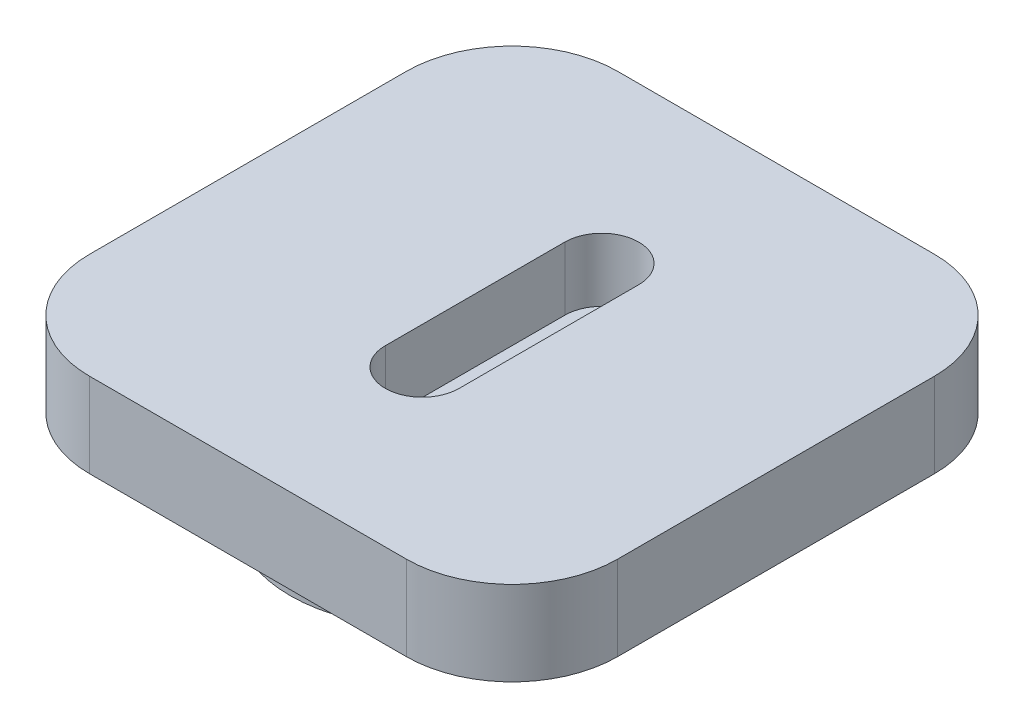
from build123d import *

# Parameters (mm, degrees)
SKETCH_1_W          = 50
SKETCH_1_H          = 50
EXTRUDE_1_DEPTH     = 12.5
FILLET_1_R          = 10
CUT_EXTRUDE_1_DEPTH = 6
SKETCH_3_R          = 3.375
CUT_EXTRUDE_2_DEPTH = 6
SKETCH_4_R          = 8.75
CUT_EXTRUDE_3_DEPTH = 3
SKETCH_5_W          = 67.74325056
SKETCH_5_H          = 59.124248938
SKETCH_5_R          = 12.5
CUT_EXTRUDE_4_DEPTH = 4.5
SKETCH_6_R          = 11.25
SKETCH_6_R_2        = 10.25
CUT_EXTRUDE_5_DEPTH = 2


with BuildPart() as part:
    # 草图1 → 凸台-拉伸1 (new body)
    with BuildSketch(Plane(origin=(0, 0, 0), x_dir=(1, 0, 0), z_dir=(0, 1, 0))):
        Rectangle(SKETCH_1_W, SKETCH_1_H)
    extrude(amount=EXTRUDE_1_DEPTH)

    # 圆角1
    fillet_1_edges = [part.edges().sort_by_distance(p)[0] for p in [
        (-25, 6.25, -25),
        (25, 6.25, -25),
        (25, 6.25, 25),
        (-25, 6.25, 25),
    ]]
    fillet(fillet_1_edges, radius=FILLET_1_R)

    # 草图2 → 切除-拉伸1 (cut)
    with BuildSketch(Plane(origin=(0, 12.5, 0), x_dir=(1, 0, 0), z_dir=(0, 1, 0))):
        with BuildLine():
            Line((3.5, 8.5), (3.5, -8.5))
            ThreePointArc((3.5, -8.5), (0, -12), (-3.5, -8.5))
            Line((-3.5, -8.5), (-3.5, 8.5))
            ThreePointArc((-3.5, 8.5), (0, 12), (3.5, 8.5))
        make_face()
    extrude(amount=-CUT_EXTRUDE_1_DEPTH, mode=Mode.SUBTRACT)

    # 草图3 → 切除-拉伸2 (cut)
    with BuildSketch(Plane(origin=(0, 6.5, 0), x_dir=(1, 0, 0), z_dir=(0, 1, 0))):
        with Locations(Location((0, -8.5, 0), (0, 0, 270))):
            Circle(SKETCH_3_R)
    extrude(amount=-CUT_EXTRUDE_2_DEPTH, mode=Mode.SUBTRACT)

    # 草图4 → 切除-拉伸3 (cut)
    with BuildSketch(Plane(origin=(0, 0, 0), x_dir=(-1, 0, 0), z_dir=(0, -1, 0))):
        with Locations(Location((0, -8.5, 0), (0, 0, 90))):
            Circle(SKETCH_4_R)
    extrude(amount=-CUT_EXTRUDE_3_DEPTH, mode=Mode.SUBTRACT)

    # 草图5 → 切除-拉伸4 (cut)
    with BuildSketch(Plane(origin=(0, 0, 0), x_dir=(-1, 0, 0), z_dir=(0, -1, 0))):
        with Locations((1.182484979, -0.052554888)):
            Rectangle(SKETCH_5_W, SKETCH_5_H)
        with Locations(Location((0, -8.5, 0), (0, 0, 90))):
            Circle(SKETCH_5_R, mode=Mode.SUBTRACT)
    extrude(amount=-CUT_EXTRUDE_4_DEPTH, mode=Mode.SUBTRACT)

    # 草图6 → 切除-拉伸5 (cut)
    with BuildSketch(Plane(origin=(0, 0, 0), x_dir=(-1, 0, 0), z_dir=(0, -1, 0))):
        with Locations(Location((0, -8.5, 0), (0, 0, 90))):
            Circle(SKETCH_6_R)
        with Locations(Location((0, -8.5, 0), (0, 0, 90))):
            Circle(SKETCH_6_R_2, mode=Mode.SUBTRACT)
    extrude(amount=-CUT_EXTRUDE_5_DEPTH, mode=Mode.SUBTRACT)


solid = part.part
